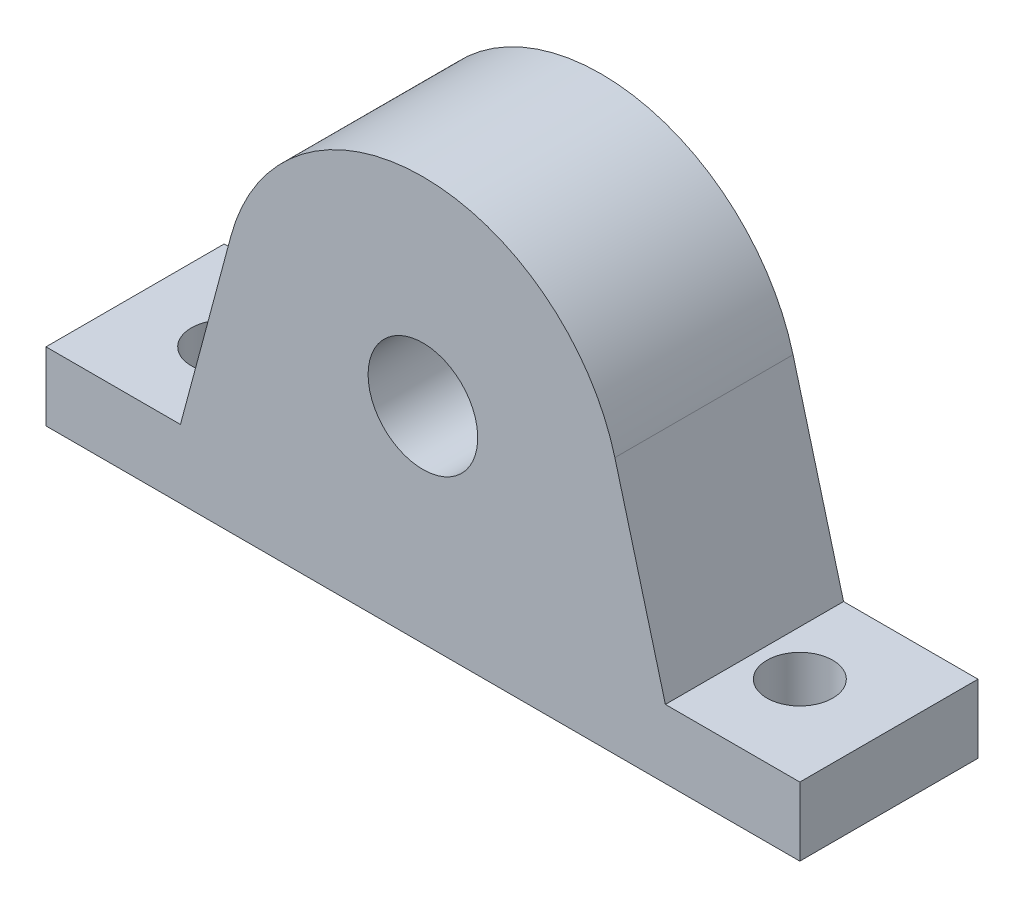
from build123d import *

# Parameters (mm, degrees)
SKETCH_1_R          = 4
EXTRUDE_1_DEPTH     = 6.5
SKETCH_2_R          = 2.4
CUT_EXTRUDE_1_DEPTH = 13


with BuildPart() as part:
    # 草图1 → 凸台-拉伸1 (new, symmetric)
    with BuildSketch(Plane.XY):
        with BuildLine():
            Line((-27.5, 0), (27.5, 0))
            Line((27.5, 0), (27.5, 5))
            Line((27.5, 5), (17.69099654, 5))
            Line((17.69099654, 5), (14.005924481, 18.752876154))
            ThreePointArc((14.005924481, 18.752876154), (0, 29.5), (-14.005924481, 18.752876154))
            Line((-14.005924481, 18.752876154), (-17.69099654, 5))
            Line((-17.69099654, 5), (-27.5, 5))
            Line((-27.5, 5), (-27.5, 0))
        make_face()
        with Locations(Location((0, 15, 0), (0, 0, 180))):
            Circle(SKETCH_1_R, mode=Mode.SUBTRACT)
    extrude(amount=EXTRUDE_1_DEPTH, both=True)

    # 草图2 → 切除-拉伸1 (cut)
    with BuildSketch(Plane(origin=(0, 5, 0), x_dir=(1, 0, 0), z_dir=(0, 1, 0))):
        with Locations(Location((-21, 0, 0), (0, 0, 180))):
            Circle(SKETCH_2_R)
        with Locations(Location((21, 0, 0), (0, 0, 180))):
            Circle(SKETCH_2_R)
    extrude(amount=-CUT_EXTRUDE_1_DEPTH, mode=Mode.SUBTRACT)


solid = part.part
